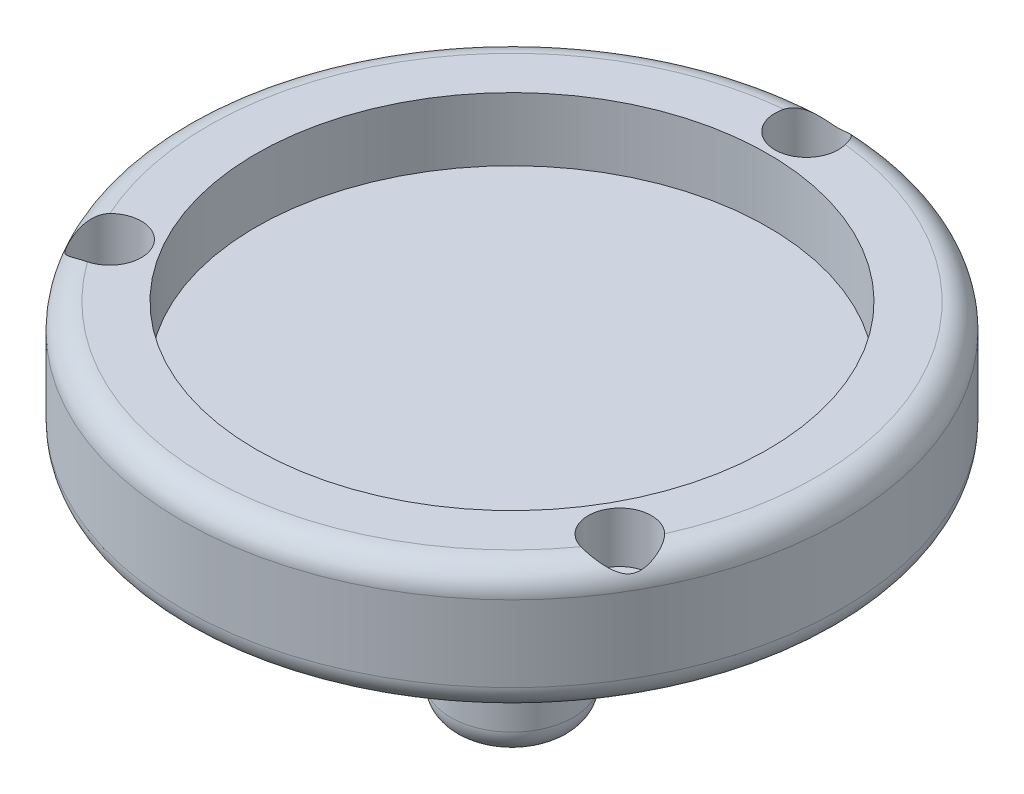
from build123d import *

# Parameters (mm, degrees)
SKETCH1_R           = 16.51
BOSS_EXTRUDE1_DEPTH = 6.35
SKETCH2_R           = 12.827
CUT_EXTRUDE1_DEPTH  = 3.175
FILLET4_R           = 1.27
SKETCH3_R           = 3.0734
BOSS_EXTRUDE3_DEPTH = 11.43
FILLET5_R           = 1.27
SKETCH4_R           = 1.5875
CUT_EXTRUDE2_DEPTH  = 2.54
CIRPATTERN1_COUNT   = 3


with BuildPart() as part:
    # Sketch1 → Boss-Extrude1 (new body)
    with BuildSketch(Plane(origin=(0, 0, 0), x_dir=(1, 0, 0), z_dir=(0, 1, 0))):
        Circle(SKETCH1_R)
    extrude(amount=BOSS_EXTRUDE1_DEPTH)

    # Sketch2 → Cut-Extrude1 (cut)
    with BuildSketch(Plane(origin=(0, 6.35, 0), x_dir=(1, 0, 0), z_dir=(0, 1, 0))):
        Circle(SKETCH2_R)
    extrude(amount=-CUT_EXTRUDE1_DEPTH, mode=Mode.SUBTRACT)

    # Fillet4
    fillet4_edges = [part.edges().sort_by_distance(p)[0] for p in [
        (-16.51, 6.35, 0),
    ]]
    fillet(fillet4_edges, radius=FILLET4_R)

    # Sketch3 → Boss-Extrude3 (add)
    with BuildSketch(Plane.XZ):
        Circle(SKETCH3_R)
    extrude(amount=BOSS_EXTRUDE3_DEPTH)

    # Fillet5
    fillet5_edges = [part.edges().sort_by_distance(p)[0] for p in [
        (-3.0734, -11.43, 0),
        (-16.51, 0, 0),
        (-3.0734, 0, 0),
    ]]
    fillet(fillet5_edges, radius=FILLET5_R)

    # Sketch4 → Cut-Extrude2 (cut)
    with BuildSketch(Plane(origin=(0, 6.35, 0), x_dir=(1, 0, 0), z_dir=(0, 1, 0))):
        with Locations((0, 14.757126775)):
            Circle(SKETCH4_R)
    cut_extrude2 = extrude(amount=-CUT_EXTRUDE2_DEPTH, mode=Mode.SUBTRACT)

    # CirPattern1: Cut-Extrude2 ×3 about axis
    cirpattern1_axis = Axis((0, 3.175, 0), (0, 1, 0))
    for i in range(1, CIRPATTERN1_COUNT):
        add(cut_extrude2.rotate(cirpattern1_axis, i * 360 / CIRPATTERN1_COUNT), mode=Mode.SUBTRACT)


solid = part.part
